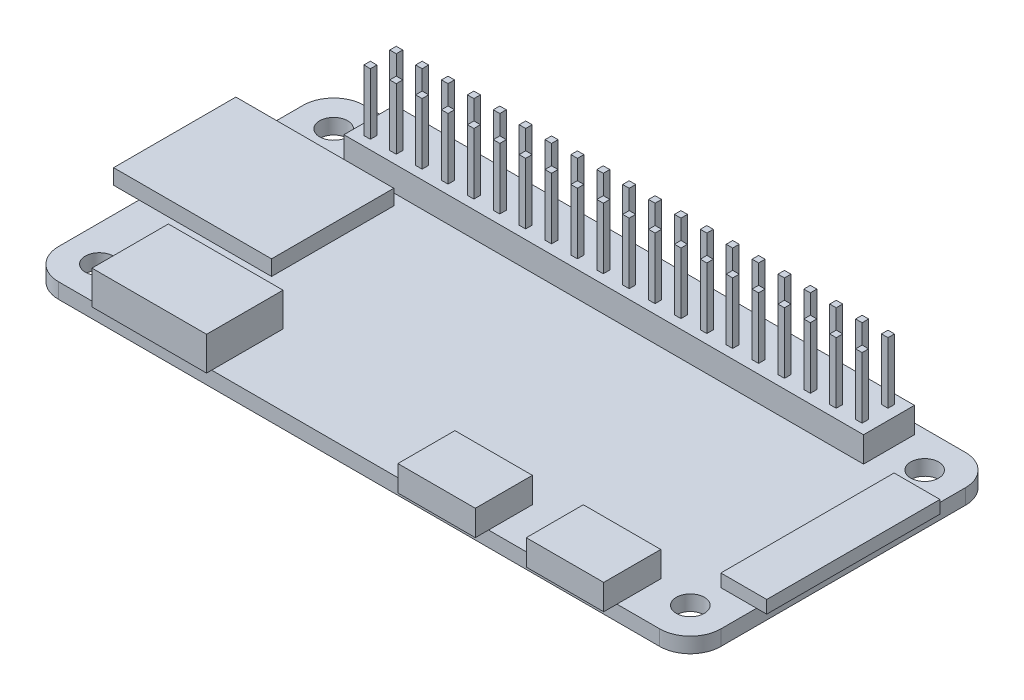
from build123d import *

# Parameters (mm, degrees)
SKETCH1_W           = 65
SKETCH1_H           = 30
BOSS_EXTRUDE1_DEPTH = 1.5
SKETCH2_OUTSIDE_W   = 81.32
SKETCH2_OUTSIDE_H   = 46.32
CUT_EXTRUDE2_DEPTH  = 36.825968235
SKETCH3_R           = 1.375
CUT_EXTRUDE3_DEPTH  = 36.825968235
SKETCH4_W           = 7.6
SKETCH4_H           = 5.6
BOSS_EXTRUDE2_DEPTH = 2.5
SKETCH5_W           = 11.25
SKETCH5_H           = 7.5
BOSS_EXTRUDE3_DEPTH = 3.3
SKETCH6_W           = 15.5
SKETCH6_H           = 12
BOSS_EXTRUDE4_DEPTH = 1.5
SKETCH7_W           = 51
SKETCH7_H           = 5
BOSS_EXTRUDE6_DEPTH = 2.5
SKETCH9_W           = 4.5
SKETCH9_H           = 17
BOSS_EXTRUDE7_DEPTH = 1.25
SKETCH10_W          = 0.64
SKETCH10_H          = 0.64
BOSS_EXTRUDE8_DEPTH = 6


with BuildPart() as part:
    # Sketch1 → Boss-Extrude1 (new body)
    with BuildSketch(Plane(origin=(0, 0, 0), x_dir=(1, 0, 0), z_dir=(0, 1, 0))):
        Rectangle(SKETCH1_W, SKETCH1_H)
    extrude(amount=BOSS_EXTRUDE1_DEPTH)

    # Sketch2 outside → Cut-Extrude2 (cut, through all)
    with BuildSketch(Plane(origin=(0, 1.5, 0), x_dir=(1, 0, 0), z_dir=(0, 1, 0))):
        Rectangle(SKETCH2_OUTSIDE_W, SKETCH2_OUTSIDE_H)
        with BuildLine():
            Line((32.5, -12), (32.5, 12))
            ThreePointArc((32.5, 12), (31.621320344, 14.121320344), (29.5, 15))
            Line((29.5, 15), (-29.5, 15))
            ThreePointArc((-29.5, 15), (-31.621320344, 14.121320344), (-32.5, 12))
            Line((-32.5, 12), (-32.5, -12))
            ThreePointArc((-32.5, -12), (-31.621320344, -14.121320344), (-29.5, -15))
            Line((-29.5, -15), (29.5, -15))
            ThreePointArc((29.5, -15), (31.621320344, -14.121320344), (32.5, -12))
        make_face(mode=Mode.SUBTRACT)
    extrude(amount=-CUT_EXTRUDE2_DEPTH, mode=Mode.SUBTRACT)

    # Sketch3 → Cut-Extrude3 (cut, through all)
    with BuildSketch(Plane(origin=(0, 1.5, 0), x_dir=(1, 0, 0), z_dir=(0, 1, 0))):
        with Locations(Location((-29, 11.5, 0), (0, 0, 270))):
            Circle(SKETCH3_R)
        with Locations(Location((29, 11.5, 0), (0, 0, 90))):
            Circle(SKETCH3_R)
        with Locations(Location((29, -11.5, 0), (0, 0, 270))):
            Circle(SKETCH3_R)
        with Locations(Location((-29, -11.5, 0), (0, 0, 90))):
            Circle(SKETCH3_R)
    extrude(amount=-CUT_EXTRUDE3_DEPTH, mode=Mode.SUBTRACT)

    # Sketch4 → Boss-Extrude2 (add)
    with BuildSketch(Plane(origin=(0, 1.5, 0), x_dir=(1, 0, 0), z_dir=(0, 1, 0))):
        with Locations((21.5, -13.5)):
            Rectangle(SKETCH4_W, SKETCH4_H)
        with Locations((8.9, -13.5)):
            Rectangle(SKETCH4_W, SKETCH4_H)
    extrude(amount=BOSS_EXTRUDE2_DEPTH)

    # Sketch5 → Boss-Extrude3 (add)
    with BuildSketch(Plane(origin=(0, 1.5, 0), x_dir=(1, 0, 0), z_dir=(0, 1, 0))):
        with Locations((-20.1, -11.75)):
            Rectangle(SKETCH5_W, SKETCH5_H)
    extrude(amount=BOSS_EXTRUDE3_DEPTH)

    # Sketch6 → Boss-Extrude4 (add)
    with BuildSketch(Plane(origin=(0, 1.5, 0), x_dir=(1, 0, 0), z_dir=(0, 1, 0))):
        with Locations((-27.25, 1.9)):
            Rectangle(SKETCH6_W, SKETCH6_H)
    extrude(amount=BOSS_EXTRUDE4_DEPTH)

    # Sketch7 → Boss-Extrude6 (add)
    with BuildSketch(Plane(origin=(0, 1.5, 0), x_dir=(1, 0, 0), z_dir=(0, 1, 0))):
        with Locations((0, 11.5)):
            Rectangle(SKETCH7_W, SKETCH7_H)
    extrude(amount=BOSS_EXTRUDE6_DEPTH)

    # Sketch9 → Boss-Extrude7 (add)
    with BuildSketch(Plane(origin=(0, 1.5, 0), x_dir=(1, 0, 0), z_dir=(0, 1, 0))):
        with Locations((31.25, 0)):
            Rectangle(SKETCH9_W, SKETCH9_H)
    extrude(amount=BOSS_EXTRUDE7_DEPTH)

    # Sketch10 → Boss-Extrude8 (add)
    with BuildSketch(Plane(origin=(0, 4, 0), x_dir=(1, 0, 0), z_dir=(0, 1, 0))):
        with Locations((-21.59, 12.77)):
            Rectangle(SKETCH10_W, SKETCH10_H)
        with Locations((-24.13, 12.77)):
            Rectangle(SKETCH10_W, SKETCH10_H)
        with Locations((-19.05, 12.77)):
            Rectangle(SKETCH10_W, SKETCH10_H)
        with Locations((-16.51, 12.77)):
            Rectangle(SKETCH10_W, SKETCH10_H)
        with Locations((-13.97, 12.77)):
            Rectangle(SKETCH10_W, SKETCH10_H)
        with Locations((-11.43, 12.77)):
            Rectangle(SKETCH10_W, SKETCH10_H)
        with Locations((-8.89, 12.77)):
            Rectangle(SKETCH10_W, SKETCH10_H)
        with Locations((-6.35, 12.77)):
            Rectangle(SKETCH10_W, SKETCH10_H)
        with Locations((-3.81, 12.77)):
            Rectangle(SKETCH10_W, SKETCH10_H)
        with Locations((-1.27, 12.77)):
            Rectangle(SKETCH10_W, SKETCH10_H)
        with Locations((24.13, 12.77)):
            Rectangle(SKETCH10_W, SKETCH10_H)
        with Locations((21.59, 12.77)):
            Rectangle(SKETCH10_W, SKETCH10_H)
        with Locations((19.05, 12.77)):
            Rectangle(SKETCH10_W, SKETCH10_H)
        with Locations((16.51, 12.77)):
            Rectangle(SKETCH10_W, SKETCH10_H)
        with Locations((13.97, 12.77)):
            Rectangle(SKETCH10_W, SKETCH10_H)
        with Locations((11.43, 12.77)):
            Rectangle(SKETCH10_W, SKETCH10_H)
        with Locations((8.89, 12.77)):
            Rectangle(SKETCH10_W, SKETCH10_H)
        with Locations((6.35, 12.77)):
            Rectangle(SKETCH10_W, SKETCH10_H)
        with Locations((3.81, 12.77)):
            Rectangle(SKETCH10_W, SKETCH10_H)
        with Locations((1.27, 12.77)):
            Rectangle(SKETCH10_W, SKETCH10_H)
        with Locations((24.13, 10.23)):
            Rectangle(SKETCH10_W, SKETCH10_H)
        with Locations((21.59, 10.23)):
            Rectangle(SKETCH10_W, SKETCH10_H)
        with Locations((19.05, 10.23)):
            Rectangle(SKETCH10_W, SKETCH10_H)
        with Locations((16.51, 10.23)):
            Rectangle(SKETCH10_W, SKETCH10_H)
        with Locations((13.97, 10.23)):
            Rectangle(SKETCH10_W, SKETCH10_H)
        with Locations((11.43, 10.23)):
            Rectangle(SKETCH10_W, SKETCH10_H)
        with Locations((8.89, 10.23)):
            Rectangle(SKETCH10_W, SKETCH10_H)
        with Locations((6.35, 10.23)):
            Rectangle(SKETCH10_W, SKETCH10_H)
        with Locations((3.81, 10.23)):
            Rectangle(SKETCH10_W, SKETCH10_H)
        with Locations((1.27, 10.23)):
            Rectangle(SKETCH10_W, SKETCH10_H)
        with Locations((-1.27, 10.23)):
            Rectangle(SKETCH10_W, SKETCH10_H)
        with Locations((-3.81, 10.23)):
            Rectangle(SKETCH10_W, SKETCH10_H)
        with Locations((-6.35, 10.23)):
            Rectangle(SKETCH10_W, SKETCH10_H)
        with Locations((-8.89, 10.23)):
            Rectangle(SKETCH10_W, SKETCH10_H)
        with Locations((-11.43, 10.23)):
            Rectangle(SKETCH10_W, SKETCH10_H)
        with Locations((-13.97, 10.23)):
            Rectangle(SKETCH10_W, SKETCH10_H)
        with Locations((-16.51, 10.23)):
            Rectangle(SKETCH10_W, SKETCH10_H)
        with Locations((-19.05, 10.23)):
            Rectangle(SKETCH10_W, SKETCH10_H)
        with Locations((-21.59, 10.23)):
            Rectangle(SKETCH10_W, SKETCH10_H)
        with Locations((-24.13, 10.23)):
            Rectangle(SKETCH10_W, SKETCH10_H)
    extrude(amount=BOSS_EXTRUDE8_DEPTH)


solid = part.part
